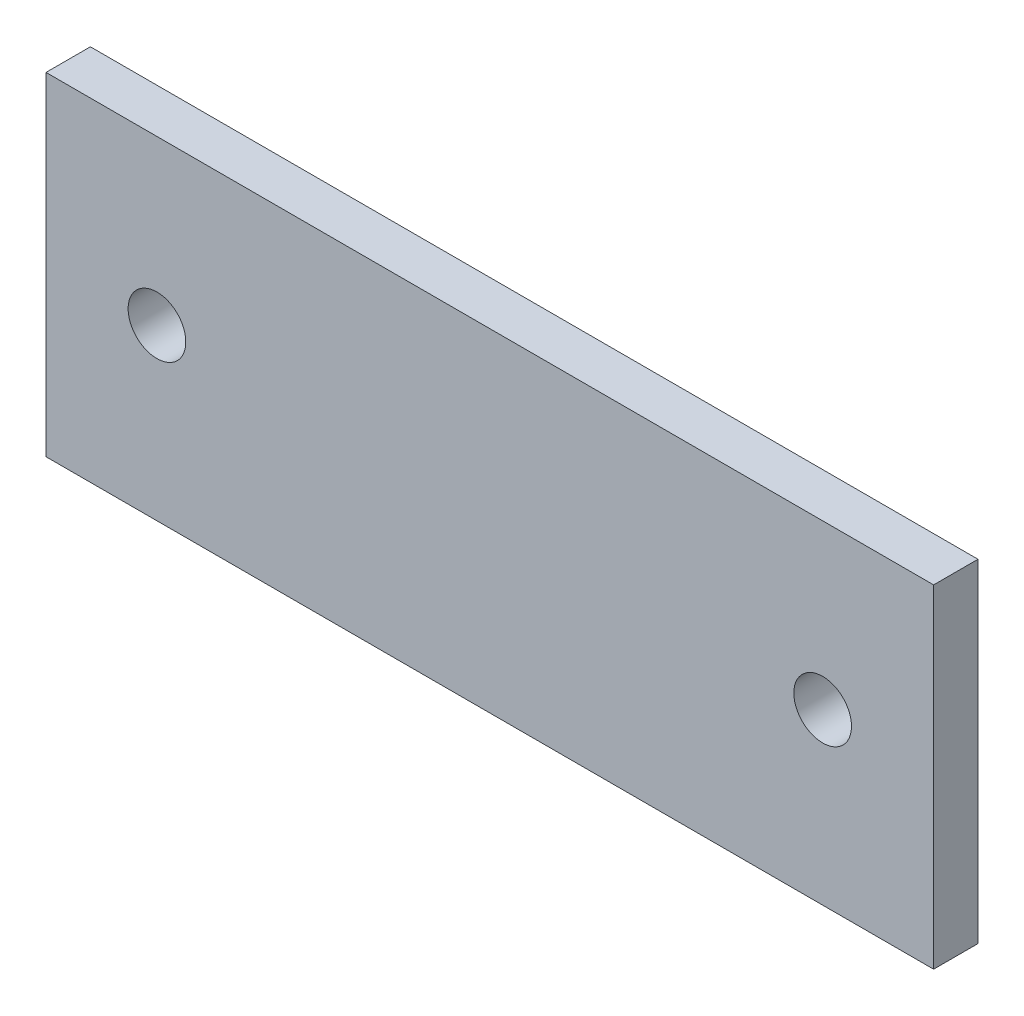
from build123d import *

# Parameters (mm, degrees)
SKETCH1_W      = 400
SKETCH1_H      = 150
SKETCH1_R      = 13
EXTRUDE1_DEPTH = 20


with BuildPart() as part:
    # Sketch1 → Extrude1 (new body)
    with BuildSketch(Plane.XY):
        with Locations((200, 75)):
            Rectangle(SKETCH1_W, SKETCH1_H)
        with Locations((50, 76.300665856)):
            Circle(SKETCH1_R, mode=Mode.SUBTRACT)
        with Locations((350, 76.300665856)):
            Circle(SKETCH1_R, mode=Mode.SUBTRACT)
    extrude(amount=EXTRUDE1_DEPTH)


solid = part.part
